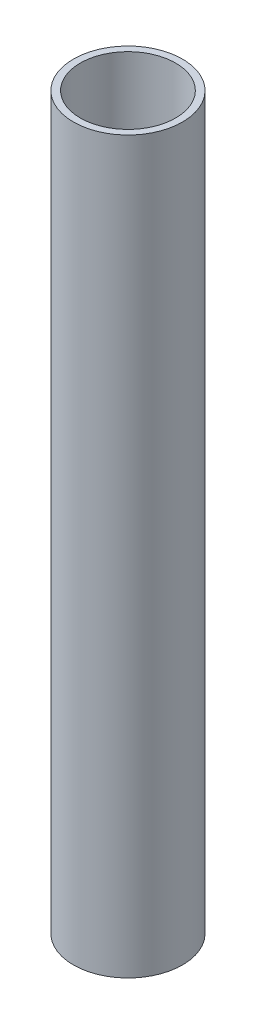
from build123d import *


with BuildPart() as part:
    # Sketch1 → Test Tube (revolve)
    with BuildSketch(Plane.XY, mode=Mode.PRIVATE) as test_tube_sk:
        Polygon((0, 0), (6.35, 0), (6.35, 85), (5.55, 85), (5.55, 1), (0, 1), align=None)
    revolve(test_tube_sk.sketch.rotate(Axis((0, 1, 0), (0, -1, 0)), 90), axis=Axis((0, 1, 0), (0, -1, 0)))


solid = part.part
